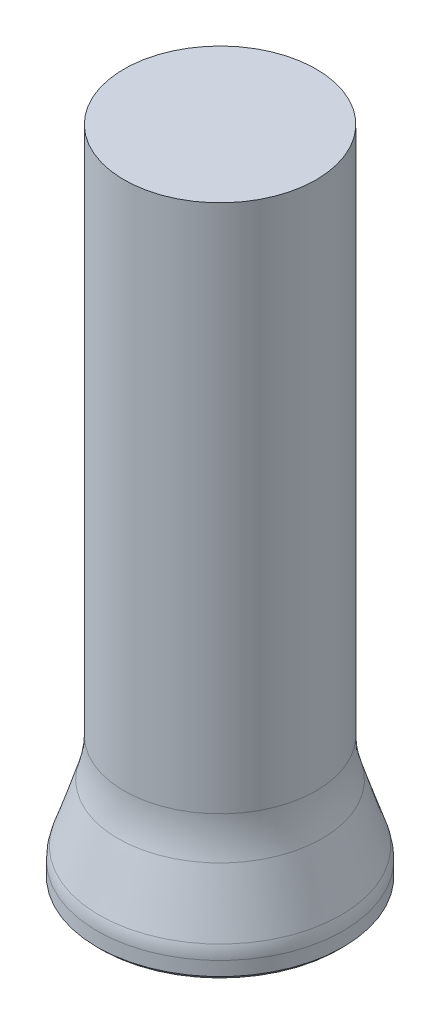
from build123d import *

# Parameters (mm, degrees)
SFAZOWANIE1_SIZE = 1


with BuildPart() as part:
    # Szkic1 → Obrót1 (revolve)
    with BuildSketch(Plane.XY, mode=Mode.PRIVATE) as obr_t1_sk:
        with BuildLine():
            Line((0, 111.071464226), (-23.45, 111.071464226))
            Line((-23.45, 111.071464226), (-23.45, -18.141136369))
            ThreePointArc((-23.45, -18.141136369), (-23.824842317, -22.868718444), (-24.940002152, -27.478160664))
            Line((-24.940002152, -27.478160664), (-29.503332616, -41.411994143))
            ThreePointArc((-29.503332616, -41.411994143), (-29.875052561, -42.948474884), (-30, -44.524335575))
            Line((-30, -44.524335575), (-30, -48.928535774))
            Line((-30, -48.928535774), (-5, -48.928535774))
            Line((-5, -48.928535774), (-5, -45.928535774))
            Line((-5, -45.928535774), (0, -45.928535774))
            Line((0, -45.928535774), (0, 111.071464226))
        make_face()
    revolve(obr_t1_sk.sketch.rotate(Axis((0, -45.928535774, 0), (0, 1, 0)), 180), axis=Axis((0, -45.928535774, 0), (0, 1, 0)))

    # Sfazowanie1
    sfazowanie1_edges = [part.edges().sort_by_distance(p)[0] for p in [
        (-5, -48.928535774, 0),
        (-30, -48.928535774, 0),
    ]]
    chamfer(sfazowanie1_edges, length=SFAZOWANIE1_SIZE)


solid = part.part
